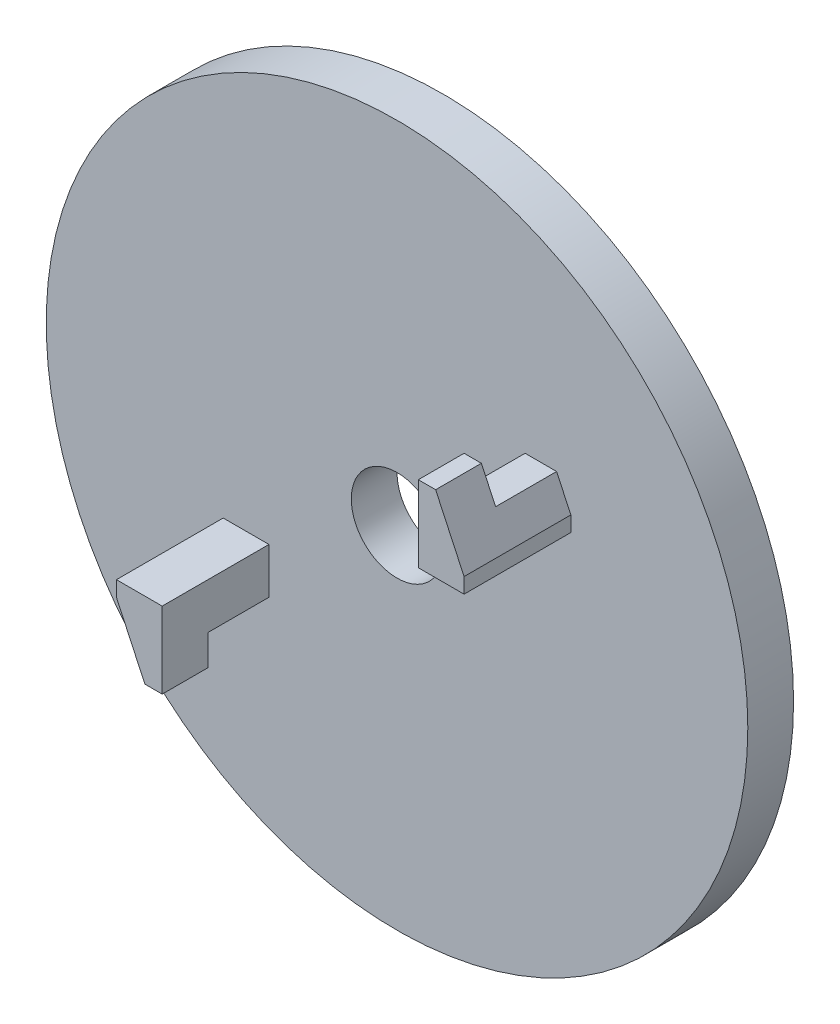
from build123d import *

# Parameters (mm, degrees)
SKETCH1_R           = 11.5
SKETCH1_R_2         = 1.5
BOSS_EXTRUDE1_DEPTH = 1.5
SKETCH2_W           = 1.5
SKETCH2_H           = 1.5
BOSS_EXTRUDE3_DEPTH = 3.5
SKETCH3_W           = 1.5
SKETCH3_H           = 1.5
BOSS_EXTRUDE4_DEPTH = 1
CHAMFER2_SIZE       = 2
CHAMFER2_SIZE2      = 0.932615316
SKETCH5_W           = 1.5
SKETCH5_H           = 1.5
BOSS_EXTRUDE6_DEPTH = 1
CHAMFER5_SIZE       = 2
CHAMFER5_SIZE2      = 0.932615316


with BuildPart() as part:
    # Sketch1 → Boss-Extrude1 (new body)
    with BuildSketch(Plane.XY):
        Circle(SKETCH1_R)
        Circle(SKETCH1_R_2, mode=Mode.SUBTRACT)
    extrude(amount=BOSS_EXTRUDE1_DEPTH)

    # Sketch2 → Boss-Extrude3 (add)
    with BuildSketch(Plane.XY.offset(1.5)):
        with Locations((4.948341792, 3.393215807)):
            Rectangle(SKETCH2_W, SKETCH2_H)
        with Locations((-4.948341792, -3.393215807)):
            Rectangle(SKETCH2_W, SKETCH2_H)
    extrude(amount=BOSS_EXTRUDE3_DEPTH)

    # Sketch3 → Boss-Extrude4 (add)
    with BuildSketch(Plane(origin=(0, 4.143215807, 0), x_dir=(1, 0, 0), z_dir=(0, 1, 0))):
        with Locations((4.948341792, -4.25)):
            Rectangle(SKETCH3_W, SKETCH3_H)
    extrude(amount=BOSS_EXTRUDE4_DEPTH)

    # Chamfer2
    chamfer2_edges = [part.edges().sort_by_distance(p)[0] for p in [
        (5.698341792, 5.143215807, 4.25),
    ]]
    chamfer2_side = [part.faces().sort_by_distance(p)[0] for p in [
        (5.698341792, 3.670993585, 3.472222222),
    ]]
    chamfer(chamfer2_edges, length=CHAMFER2_SIZE, length2=CHAMFER2_SIZE2, reference=chamfer2_side[0])

    # Sketch5 → Boss-Extrude6 (add)
    with BuildSketch(Plane.XZ.offset(4.143215807)):
        with Locations((-4.948341792, 4.25)):
            Rectangle(SKETCH5_W, SKETCH5_H)
    extrude(amount=BOSS_EXTRUDE6_DEPTH)

    # Chamfer5
    chamfer5_edges = [part.edges().sort_by_distance(p)[0] for p in [
        (-5.698341792, -5.143215807, 4.25),
    ]]
    chamfer5_side = [part.faces().sort_by_distance(p)[0] for p in [
        (-5.698341792, -3.670993585, 3.472222222),
    ]]
    chamfer(chamfer5_edges, length=CHAMFER5_SIZE, length2=CHAMFER5_SIZE2, reference=chamfer5_side[0])


solid = part.part
